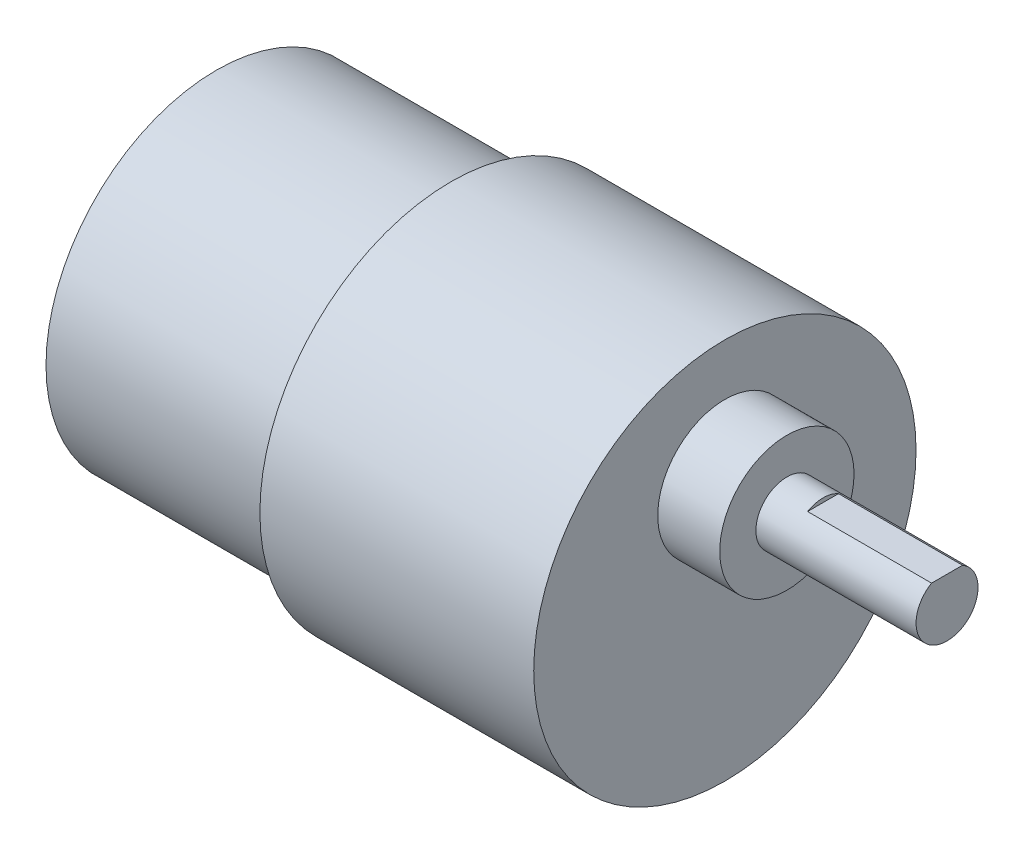
from build123d import *

# Parameters (mm, degrees)
SKETCH_1_R               = 16.5
EXTRUDE_1_DEPTH          = 22.7
SKETCH_2_R               = 18.5
EXTRUDE_2_DEPTH          = 24
SKETCH_3_R               = 6.5
EXTRUDE_3_DEPTH          = 8.5
SKETCH_5_R               = 1.5
CUT_EXTRUDE_2_DEPTH      = 10
SKETCH_2_2_R             = 18.5
EXTRUDE_4_DEPTH          = 26.5
SKETCH_3_2_R             = 6.5
EXTRUDE_5_DEPTH          = 6
SKETCH_9_R               = 3
EXTRUDE_6_DEPTH          = 15.5
CUT_EXTRUDE_3_DEPTH      = 76.385608706
CUT_EXTRUDE_3_DEPTH_BACK = 12
SKETCH_11_R              = 6
EXTRUDE_7_DEPTH          = 2
FILLET_1_R               = 0.5


with BuildPart() as part:
    # 草图1 → 凸台-拉伸1 (new body)
    with BuildSketch(Plane(origin=(0, 0, 0), x_dir=(0, 0, -1), z_dir=(1, 0, 0))):
        Circle(SKETCH_1_R)
    extrude(amount=EXTRUDE_1_DEPTH)

    # 草图2 → 凸台-拉伸2 (add)
    with BuildSketch(Plane(origin=(22.7, 0, 0), x_dir=(0, 0, -1), z_dir=(1, 0, 0))):
        Circle(SKETCH_2_R)
    extrude(amount=EXTRUDE_2_DEPTH)

    # 草图3 → 凸台-拉伸3 (add)
    with BuildSketch(Plane(origin=(46.7, 0, 0), x_dir=(0, 0, -1), z_dir=(1, 0, 0))):
        with Locations((0, 7)):
            Circle(SKETCH_3_R)
    extrude(amount=EXTRUDE_3_DEPTH)

    # 草图5 → 切除-拉伸2 (cut)
    with BuildSketch(Plane(origin=(46.7, 0, 0), x_dir=(0, 0, -1), z_dir=(1, 0, 0))):
        with Locations((-15.5, 0)):
            Circle(SKETCH_5_R)
        with Locations((-7.75, 13.423393759)):
            Circle(SKETCH_5_R)
        with Locations((7.75, 13.423393759)):
            Circle(SKETCH_5_R)
        with Locations((15.5, 0)):
            Circle(SKETCH_5_R)
        with Locations((7.75, -13.423393759)):
            Circle(SKETCH_5_R)
        with Locations((-7.75, -13.423393759)):
            Circle(SKETCH_5_R)
    extrude(amount=-CUT_EXTRUDE_2_DEPTH, mode=Mode.SUBTRACT)

    # 草图2<2> → 凸台-拉伸4 (add)
    with BuildSketch(Plane(origin=(22.7, 0, 0), x_dir=(0, 0, -1), z_dir=(1, 0, 0))):
        Circle(SKETCH_2_2_R)
    extrude(amount=EXTRUDE_4_DEPTH)

    # 草图3<2> → 凸台-拉伸5 (add)
    with BuildSketch(Plane(origin=(46.7, 0, 0), x_dir=(0, 0, -1), z_dir=(1, 0, 0))):
        with Locations((0, 7)):
            Circle(SKETCH_3_2_R)
    extrude(amount=EXTRUDE_5_DEPTH)

    # 草图9 → 凸台-拉伸6 (add)
    with BuildSketch(Plane(origin=(55.2, 0, 0), x_dir=(0, 0, -1), z_dir=(1, 0, 0))):
        with Locations((0, 7)):
            Circle(SKETCH_9_R)
    extrude(amount=EXTRUDE_6_DEPTH)

    # 草图10 → 切除-拉伸3 (cut, two sides: drawn at the far end of the back side and taken through both)
    with BuildSketch(Plane(origin=(70.7, 0, 0), x_dir=(0, 0, -1), z_dir=(1, 0, 0)).offset(-CUT_EXTRUDE_3_DEPTH_BACK)):
        Polygon((-80.474239871, 9.6), (-1.496662955, 9.6), (1.496662955, 9.6), (80.474239871, 9.6), (80.474239871, 167.555153833), (-80.474239871, 167.555153833), align=None)
    extrude(amount=CUT_EXTRUDE_3_DEPTH + CUT_EXTRUDE_3_DEPTH_BACK, mode=Mode.SUBTRACT)

    # 草图11 → 凸台-拉伸7 (add)
    with BuildSketch(Plane.ZY):
        Circle(SKETCH_11_R)
    extrude(amount=EXTRUDE_7_DEPTH)

    # 圆角1
    fillet_1_edges = [part.edges().sort_by_distance(p)[0] for p in [
        (-2, 0, -6),
    ]]
    fillet(fillet_1_edges, radius=FILLET_1_R)


solid = part.part
